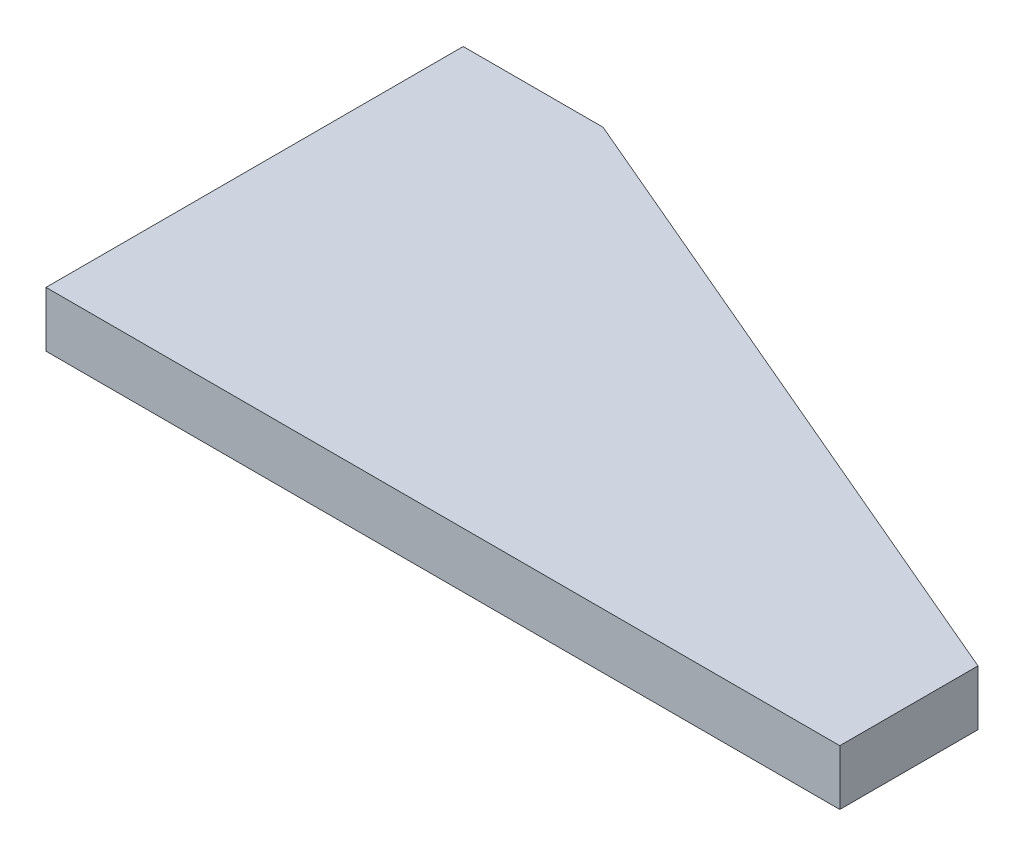
from build123d import *

# Parameters (mm, degrees)
EXTRUDE_1_DEPTH = 4


with BuildPart() as part:
    # Эскиз1 → Вытянуть1 (new body)
    with BuildSketch(Plane(origin=(0, 0, 0), x_dir=(1, 0, 0), z_dir=(0, 1, 0))):
        Polygon((10.12110211, 30.186976108), (57.434127614, 9.999999974), (57.434127614, 0), (0, 0), (0, 30.186976108), align=None)
    extrude(amount=EXTRUDE_1_DEPTH)


solid = part.part
